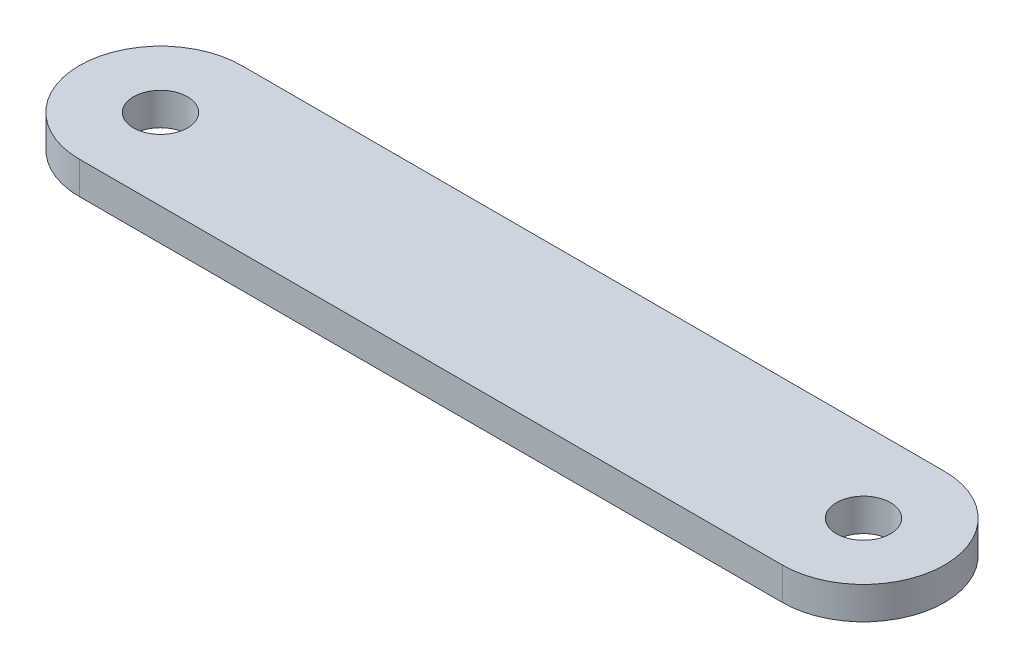
from build123d import *

# Parameters (mm, degrees)
SKETCH2_R           = 5
BOSS_EXTRUDE1_DEPTH = 6


with BuildPart() as part:
    # Sketch2 → Boss-Extrude1 (new body)
    with BuildSketch(Plane(origin=(0, 0, 0), x_dir=(1, 0, 0), z_dir=(0, 1, 0))):
        with BuildLine():
            Line((-6.5, 28.5), (123.5, 28.5))
            ThreePointArc((123.5, 28.5), (138.5, 13.5), (123.5, -1.5))
            Line((123.5, -1.5), (-6.5, -1.5))
            ThreePointArc((-6.5, -1.5), (-21.5, 13.5), (-6.5, 28.5))
        make_face()
        with Locations(Location((-6.5, 13.5, 0), (0, 0, 270))):
            Circle(SKETCH2_R, mode=Mode.SUBTRACT)
        with Locations(Location((123.5, 13.5, 0), (0, 0, 270))):
            Circle(SKETCH2_R, mode=Mode.SUBTRACT)
    extrude(amount=BOSS_EXTRUDE1_DEPTH)


solid = part.part
